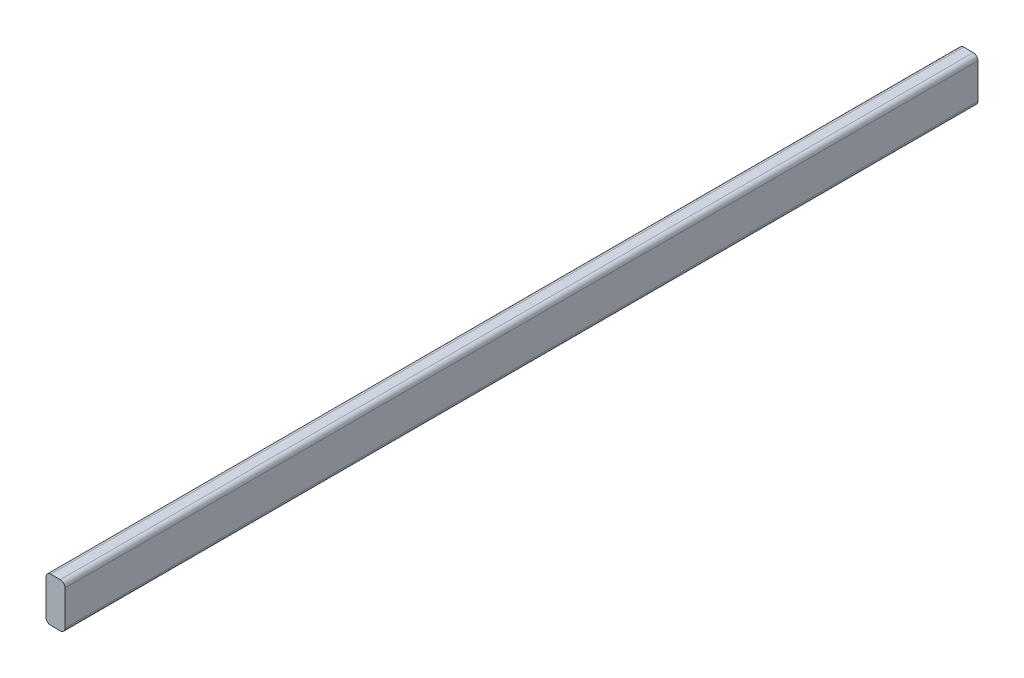
from build123d import *

# Parameters (mm, degrees)
BOSS_EXTRUDE1_DEPTH      = 457.2
BOSS_EXTRUDE1_DEPTH_BACK = 457.2
SKETCH3_W                = 19.05
SKETCH3_H                = 44.45
FILLET1_R                = 4.7625


with BuildPart() as part:
    # Sketch3 → Boss-Extrude1 (new, two sides: drawn at the far end of the back side and taken through both)
    with BuildSketch(Plane.XY.offset(-BOSS_EXTRUDE1_DEPTH_BACK)):
        Rectangle(SKETCH3_W, SKETCH3_H)
    extrude(amount=BOSS_EXTRUDE1_DEPTH + BOSS_EXTRUDE1_DEPTH_BACK)

    # Fillet1
    fillet1_edges = [part.edges().sort_by_distance(p)[0] for p in [
        (9.525, -22.225, 0),
        (-9.525, -22.225, 0),
        (-9.525, 22.225, 0),
        (9.525, 22.225, 0),
    ]]
    fillet(fillet1_edges, radius=FILLET1_R)


solid = part.part
